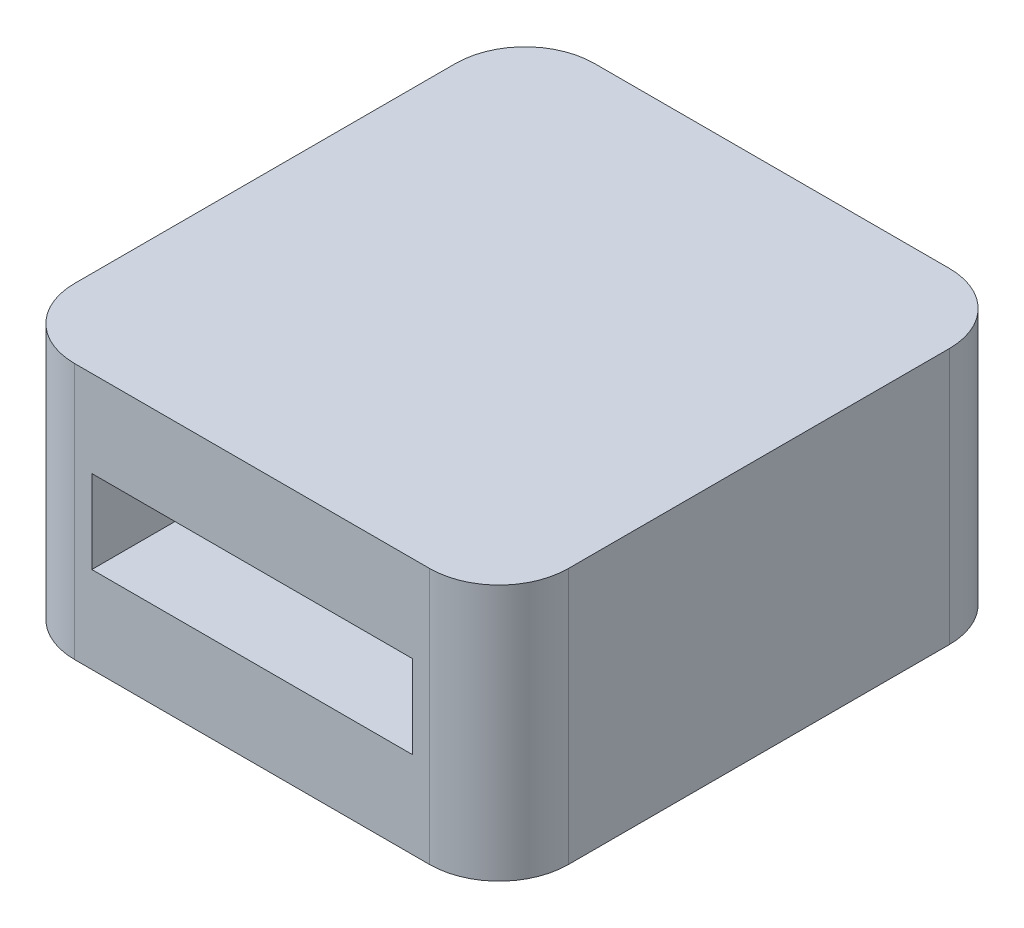
from build123d import *

# Parameters (mm, degrees)
PROFILE_SKETCH_W      = 14.25
PROFILE_SKETCH_H      = 7.4
PROFILE_SKETCH_W_2    = 9.25
PROFILE_SKETCH_H_2    = 2.4
PROFILE_EXTRUDE_DEPTH = 15
CORNER_FILLETS_R      = 2


with BuildPart() as part:
    # Profile Sketch → Profile Extrude (new body)
    with BuildSketch(Plane.XY):
        Rectangle(PROFILE_SKETCH_W, PROFILE_SKETCH_H)
        Rectangle(PROFILE_SKETCH_W_2, PROFILE_SKETCH_H_2, mode=Mode.SUBTRACT)
    extrude(amount=PROFILE_EXTRUDE_DEPTH)

    # Corner Fillets
    corner_fillets_edges = [part.edges().sort_by_distance(p)[0] for p in [
        (-7.125, 0, 15),
        (7.125, 0, 15),
        (-7.125, 0, 0),
        (7.125, 0, 0),
    ]]
    fillet(corner_fillets_edges, radius=CORNER_FILLETS_R)


solid = part.part
